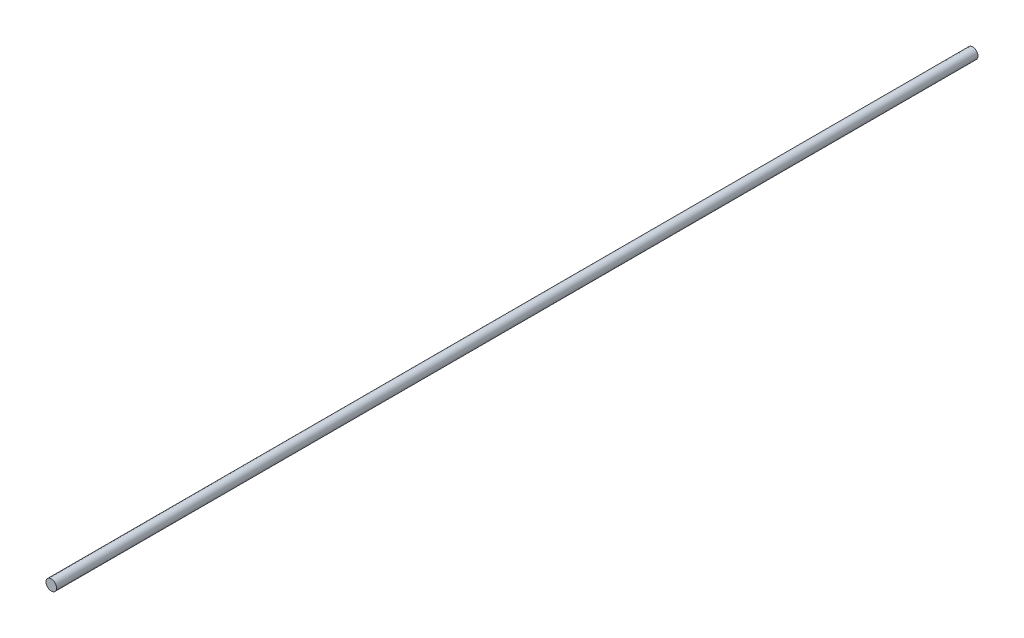
from build123d import *

# Parameters (mm, degrees)
SKETCH1_R           = 6.35
BOSS_EXTRUDE1_DEPTH = 1106.427699191


with BuildPart() as part:
    # Sketch1 → Boss-Extrude1 (new body)
    with BuildSketch(Plane.XY):
        Circle(SKETCH1_R)
    extrude(amount=BOSS_EXTRUDE1_DEPTH)


solid = part.part
